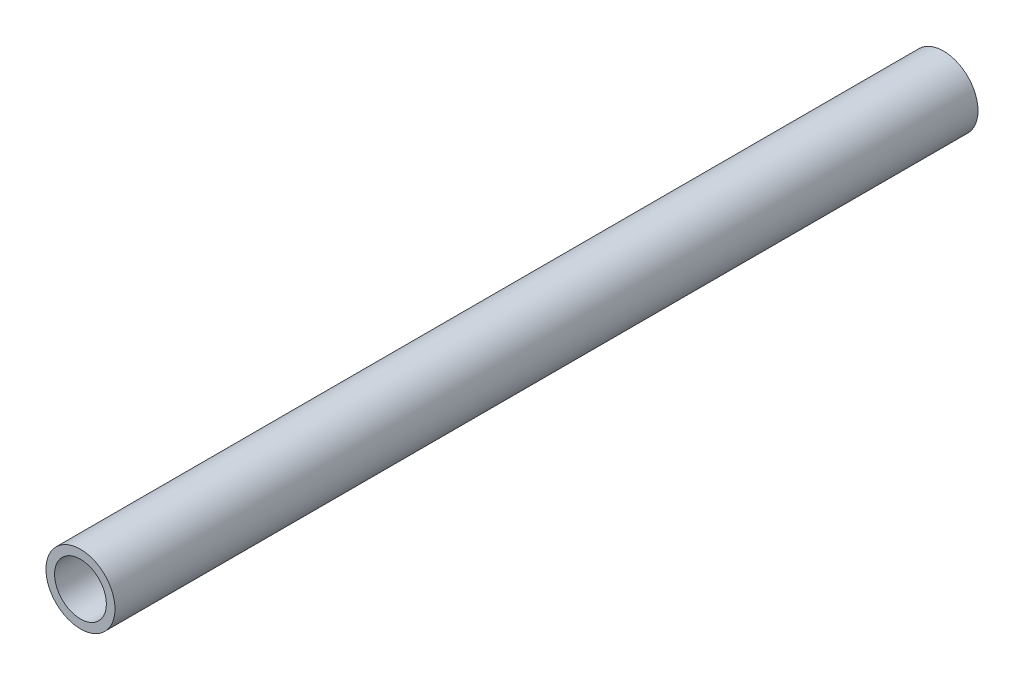
from build123d import *

# Parameters (mm, degrees)
SKETCH1_R           = 4
SKETCH1_R_2         = 3
BOSS_EXTRUDE1_DEPTH = 100


with BuildPart() as part:
    # Sketch1 → Boss-Extrude1 (new body)
    with BuildSketch(Plane.XY):
        Circle(SKETCH1_R)
        Circle(SKETCH1_R_2, mode=Mode.SUBTRACT)
    extrude(amount=BOSS_EXTRUDE1_DEPTH)


solid = part.part
